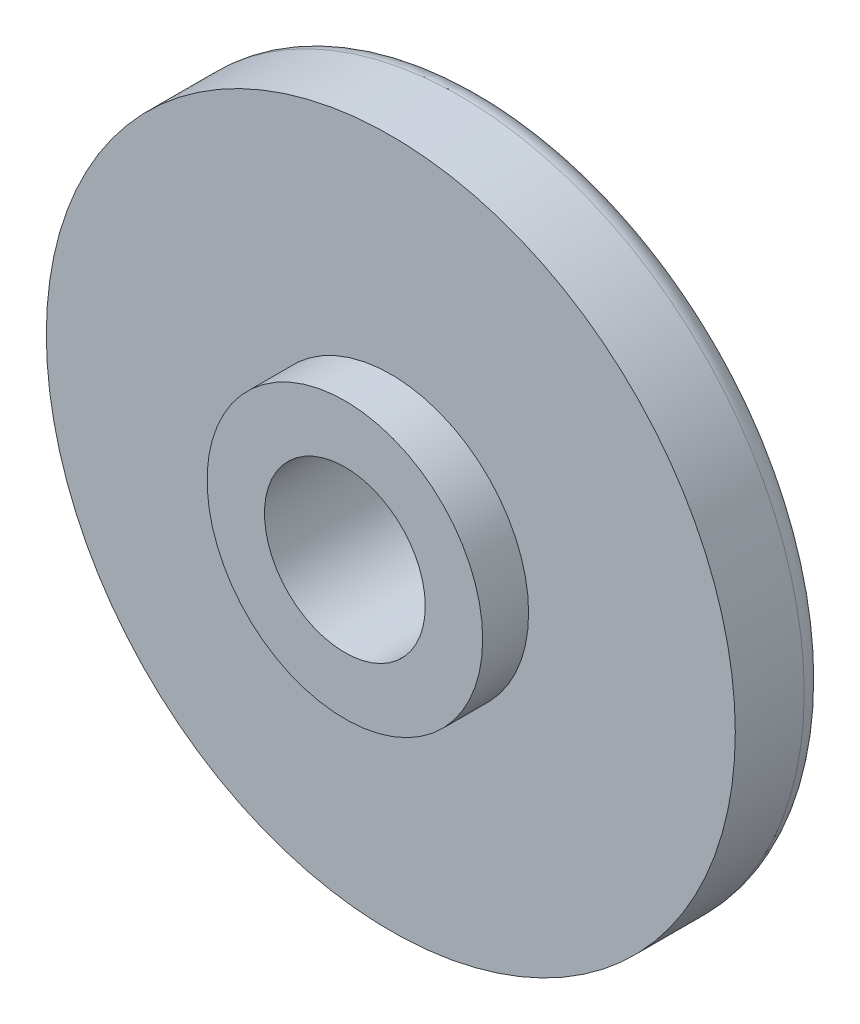
from build123d import *

# Parameters (mm, degrees)
SKETCH1_R           = 7.5
SKETCH1_R_2         = 1.75
BOSS_EXTRUDE1_DEPTH = 2
SKETCH2_R           = 3
SKETCH2_R_2         = 1.75
BOSS_EXTRUDE2_DEPTH = 1
FILLET1_R           = 0.5


with BuildPart() as part:
    # Sketch1 → Boss-Extrude1 (new body)
    with BuildSketch(Plane.XY):
        Circle(SKETCH1_R)
        Circle(SKETCH1_R_2, mode=Mode.SUBTRACT)
    extrude(amount=BOSS_EXTRUDE1_DEPTH)

    # Sketch2 → Boss-Extrude2 (add)
    with BuildSketch(Plane.XY.offset(2)):
        Circle(SKETCH2_R)
        Circle(SKETCH2_R_2, mode=Mode.SUBTRACT)
    extrude(amount=BOSS_EXTRUDE2_DEPTH)

    # Fillet1
    fillet1_edges = [part.edges().sort_by_distance(p)[0] for p in [
        (-7.5, 0, 0),
    ]]
    fillet(fillet1_edges, radius=FILLET1_R)


solid = part.part
